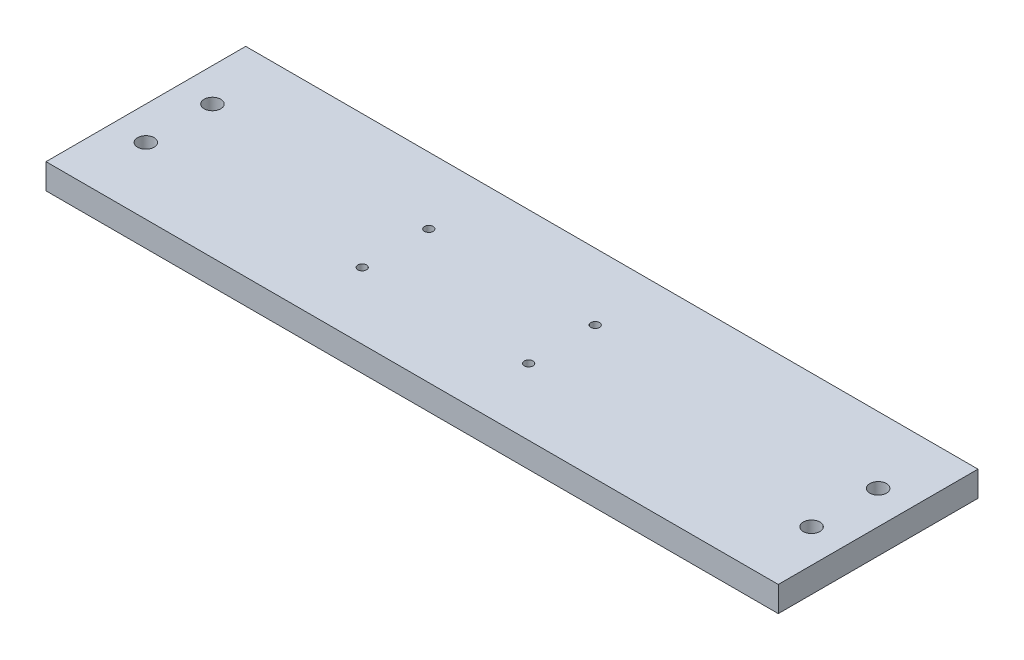
from build123d import *

# Parameters (mm, degrees)
SKETCH1_W           = 279.4
SKETCH1_H           = 76.2
BOSS_EXTRUDE1_DEPTH = 9.652
SKETCH2_R           = 3.175
SKETCH2_R_2         = 1.651
CUT_EXTRUDE1_DEPTH  = 9.652


with BuildPart() as part:
    # Sketch1 → Boss-Extrude1 (new body)
    with BuildSketch(Plane(origin=(0, 0, 0), x_dir=(1, 0, 0), z_dir=(0, 1, 0))):
        Rectangle(SKETCH1_W, SKETCH1_H)
    extrude(amount=BOSS_EXTRUDE1_DEPTH)

    # Sketch2 → Cut-Extrude1 (cut)
    with BuildSketch(Plane(origin=(0, 9.652, 0), x_dir=(1, 0, 0), z_dir=(0, 1, 0))):
        with Locations(Location((-127, 12.7, 0), (0, 0, 270))):
            Circle(SKETCH2_R)
        with Locations(Location((-44.45, 12.7, 0), (0, 0, 270))):
            Circle(SKETCH2_R_2)
        with Locations(Location((19.05, 12.7, 0), (0, 0, 270))):
            Circle(SKETCH2_R_2)
        with Locations(Location((127, 12.7, 0), (0, 0, 270))):
            Circle(SKETCH2_R)
        with Locations(Location((127, -12.7, 0), (0, 0, 90))):
            Circle(SKETCH2_R)
        with Locations(Location((19.05, -12.7, 0), (0, 0, 90))):
            Circle(SKETCH2_R_2)
        with Locations(Location((-44.45, -12.7, 0), (0, 0, 90))):
            Circle(SKETCH2_R_2)
        with Locations(Location((-127, -12.7, 0), (0, 0, 90))):
            Circle(SKETCH2_R)
    extrude(amount=-CUT_EXTRUDE1_DEPTH, mode=Mode.SUBTRACT)


solid = part.part
